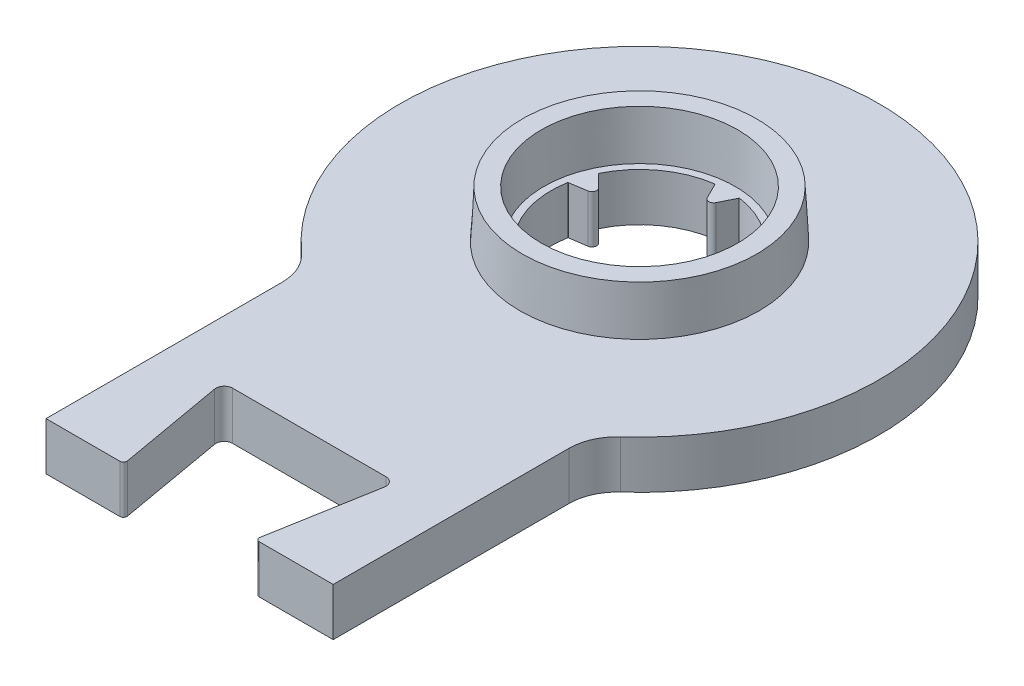
from build123d import *

# Parameters (mm, degrees)
SKETCH1_R           = 3.7
BOSS_EXTRUDE1_DEPTH = 2
SKETCH2_R           = 10
SKETCH2_R_2         = 3.8
BOSS_EXTRUDE2_DEPTH = 2
SKETCH4_W           = 12
SKETCH4_H           = 0.2
CUT_EXTRUDE1_DEPTH  = 4
FILLET3_R           = 0.35
FILLET4_R           = 0.15
FILLET6_R           = 2
BOSS_EXTRUDE6_DEPTH = 2
CIRPATTERN1_COUNT   = 5
SKETCH11_R          = 5
SKETCH11_R_2        = 4
BOSS_EXTRUDE7_DEPTH = 2
BOSS_EXTRUDE7_DRAFT = 3
FILLET10_R          = 0.2


with BuildPart() as part:
    # Sketch1 → Boss-Extrude1 (new body)
    with BuildSketch(Plane(origin=(0, 0, 0), x_dir=(1, 0, 0), z_dir=(0, 1, 0))):
        Polygon((-6, 6), (-6, -13.291502622), (-6, -19), (-2.70227506, -19), (-3.619175359, -13.8), (0, -13.8), (3.619175359, -13.8), (2.70227506, -19), (6, -19), (6, -13.291502622), (6, 6), align=None)
        with Locations(Location((0, 0, 0), (0, 0, 270))):
            Circle(SKETCH1_R, mode=Mode.SUBTRACT)
    extrude(amount=BOSS_EXTRUDE1_DEPTH)

    # Sketch2 → Boss-Extrude2 (add)
    with BuildSketch(Plane(origin=(0, 0, 0), x_dir=(1, 0, 0), z_dir=(0, 1, 0))):
        Circle(SKETCH2_R)
        Circle(SKETCH2_R_2, mode=Mode.SUBTRACT)
    extrude(amount=BOSS_EXTRUDE2_DEPTH)

    # Sketch4 → Cut-Extrude1 (cut)
    with BuildSketch(Plane(origin=(0, 2, 0), x_dir=(1, 0, 0), z_dir=(0, 1, 0))):
        with Locations((0, -18.9)):
            Rectangle(SKETCH4_W, SKETCH4_H)
    extrude(amount=-CUT_EXTRUDE1_DEPTH, mode=Mode.SUBTRACT)

    # Fillet3
    fillet3_edges = [part.edges().sort_by_distance(p)[0] for p in [
        (3.619175359, 1, 13.8),
        (-3.619175359, 1, 13.8),
    ]]
    fillet(fillet3_edges, radius=FILLET3_R)

    # Fillet4
    fillet4_edges = [part.edges().sort_by_distance(p)[0] for p in [
        (2.737540456, 1, 18.8),
        (-2.737540456, 1, 18.8),
    ]]
    fillet(fillet4_edges, radius=FILLET4_R)

    # Fillet6
    fillet6_edges = [part.edges().sort_by_distance(p)[0] for p in [
        (6, 1, 8),
        (-6, 1, 8),
    ]]
    fillet(fillet6_edges, radius=FILLET6_R)

    # Sketch8 → Boss-Extrude6 (add)
    with BuildSketch(Plane(origin=(0, 2, 0), x_dir=(1, 0, 0), z_dir=(0, 1, 0))):
        Polygon((-0.5, 3.65), (0, 2.65), (0.5, 3.65), (0.5, 4.15), (-0.5, 4.15), align=None)
    boss_extrude6 = extrude(amount=-BOSS_EXTRUDE6_DEPTH)

    # CirPattern1: Boss-Extrude6 ×5 about axis
    cirpattern1_axis = Axis((0, 0, 0), (0, 1, 0))
    for i in range(1, CIRPATTERN1_COUNT):
        add(boss_extrude6.rotate(cirpattern1_axis, i * 360 / CIRPATTERN1_COUNT))


with BuildPart() as boss_extrude7_tool:
    # Sketch11 → Boss-Extrude7 (with draft: the straight prism first)
    with BuildSketch(Plane(origin=(0, 2, 0), x_dir=(1, 0, 0), z_dir=(0, 1, 0))):
        Circle(SKETCH11_R)
        Circle(SKETCH11_R_2, mode=Mode.SUBTRACT)
    extrude(amount=BOSS_EXTRUDE7_DEPTH)
    # Boss-Extrude7: the draft: its side faces are tilted about the plane it starts from
    boss_extrude7_sides = [boss_extrude7_tool.faces().sort_by_distance(p)[0] for p in [
        (-5, 3, 0),
        (-4, 3, 0),
    ]]
    draft(boss_extrude7_sides, Plane(origin=(0, 2, 0), x_dir=(1, 0, 0), z_dir=(0, 1, 0)), BOSS_EXTRUDE7_DRAFT)


with BuildPart() as part_1:
    add(part.part)

    # Boss-Extrude7: add boss_extrude7_tool
    add(boss_extrude7_tool.part)

    # Fillet10
    fillet10_edges = [part_1.edges().sort_by_distance(p)[0] for p in [
        (0, 1, -2.65),
        (2.520299768, 1, -0.818895035),
        (1.557630919, 1, 2.143895035),
        (-1.557630919, 1, 2.143895035),
        (-2.520299768, 1, -0.818895035),
    ]]
    fillet(fillet10_edges, radius=FILLET10_R)


solid = part_1.part
